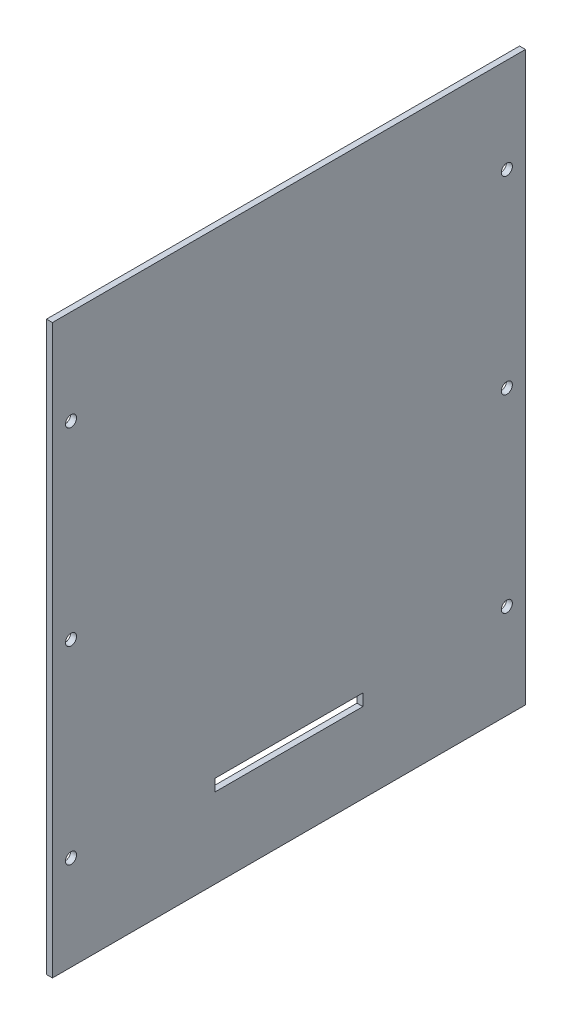
from build123d import *

# Parameters (mm, degrees)
SKETCH1_W           = 3.175
SKETCH1_H           = 254
BOSS_EXTRUDE1_DEPTH = 152.4
SKETCH2_W           = 79.375
SKETCH2_H           = 6.35
CUT_EXTRUDE1_DEPTH  = 3.175
SKETCH3_R           = 2.97688
CUT_EXTRUDE2_DEPTH  = 3.175


with BuildPart() as part:
    # Sketch1 → Boss-Extrude1 (new, symmetric)
    with BuildSketch(Plane(origin=(0, 0, 0), x_dir=(1, 0, 0), z_dir=(0, 1, 0))):
        Rectangle(SKETCH1_W, SKETCH1_H)
    extrude(amount=BOSS_EXTRUDE1_DEPTH, both=True)

    # Sketch2 → Cut-Extrude1 (cut)
    with BuildSketch(Plane(origin=(1.5875, 0, 0), x_dir=(0, 0, -1), z_dir=(1, 0, 0))):
        with Locations((0, -106.3625)):
            Rectangle(SKETCH2_W, SKETCH2_H)
    extrude(amount=-CUT_EXTRUDE1_DEPTH, mode=Mode.SUBTRACT)

    # Sketch3 → Cut-Extrude2 (cut)
    with BuildSketch(Plane(origin=(1.5875, 0, 0), x_dir=(0, 0, -1), z_dir=(1, 0, 0))):
        with Locations((117, 0)):
            Circle(SKETCH3_R)
        with Locations((117, 101.6)):
            Circle(SKETCH3_R)
        with Locations(Location((117, -101.6, 0), (0, 0, 180))):
            Circle(SKETCH3_R)
        with Locations((-117, -101.6)):
            Circle(SKETCH3_R)
        with Locations(Location((-117, 0, 0), (0, 0, 180))):
            Circle(SKETCH3_R)
        with Locations(Location((-117, 101.6, 0), (0, 0, 180))):
            Circle(SKETCH3_R)
    extrude(amount=-CUT_EXTRUDE2_DEPTH, mode=Mode.SUBTRACT)


solid = part.part
